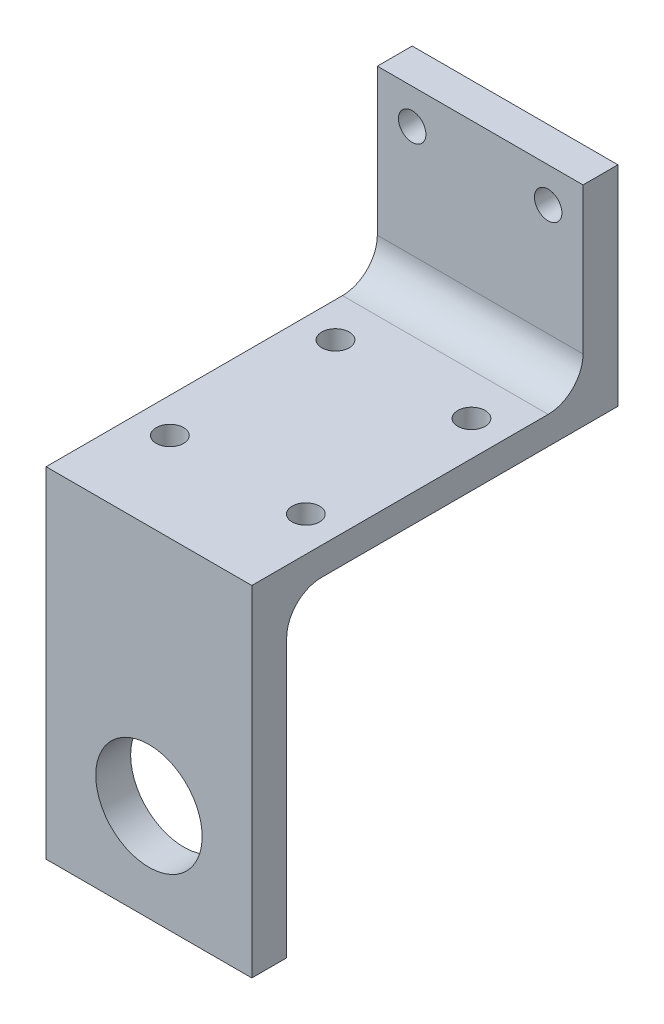
from build123d import *

# Parameters (mm, degrees)
BOSS_EXTRUDE1_DEPTH = 29.972
FILLET1_R           = 5.08
SKETCH3_R           = 2
SKETCH3_R_2         = 4
CUT_EXTRUDE1_DEPTH  = 5.08
SKETCH4_R           = 2
CUT_EXTRUDE2_DEPTH  = 29.972
SKETCH5_R           = 7.75
CUT_EXTRUDE3_DEPTH  = 5.08


with BuildPart() as part:
    # Sketch2 → Boss-Extrude1 (new body)
    with BuildSketch(Plane(origin=(0, 0, 0), x_dir=(0, 0, -1), z_dir=(1, 0, 0))):
        Polygon((6.609800113, 17.56515608), (6.609800113, -8.85084392), (-41.650199887, -8.85084392), (-41.650199887, -58.38084392), (-36.570199887, -58.38084392), (-36.570199887, -12.91484392), (11.689800113, -12.91484392), (11.689800113, 17.56515608), align=None)
    extrude(amount=BOSS_EXTRUDE1_DEPTH)

    # Fillet1
    fillet1_edges = [part.edges().sort_by_distance(p)[0] for p in [
        (14.986, -8.85084392, -6.609800113),
        (14.986, -12.91484392, 36.570199887),
    ]]
    fillet(fillet1_edges, radius=FILLET1_R)

    # Sketch3 → Cut-Extrude1 (cut)
    with BuildSketch(Plane(origin=(0, 0, -11.689800113), x_dir=(-1, 0, 0), z_dir=(0, 0, -1))):
        with Locations((-24.892, 12.48515608)):
            Circle(SKETCH3_R)
        with Locations((-5.08, 12.48515608)):
            Circle(SKETCH3_R)
        with Locations((-5.08, -11.64484392)):
            Circle(SKETCH3_R_2)
        with Locations((-24.892, -11.64484392)):
            Circle(SKETCH3_R_2)
    extrude(amount=-CUT_EXTRUDE1_DEPTH, mode=Mode.SUBTRACT)

    # Sketch4 → Cut-Extrude2 (cut)
    with BuildSketch(Plane.XZ.offset(12.91484392)):
        with Locations(Location((24.892, 4.566199887, 0), (0, 0, 270))):
            Circle(SKETCH4_R)
        with Locations(Location((5.08, 4.566199887, 0), (0, 0, 270))):
            Circle(SKETCH4_R)
        with Locations(Location((24.892, 28.696199887, 0), (0, 0, 270))):
            Circle(SKETCH4_R)
        with Locations(Location((5.08, 28.696199887, 0), (0, 0, 270))):
            Circle(SKETCH4_R)
    extrude(amount=-CUT_EXTRUDE2_DEPTH, mode=Mode.SUBTRACT)

    # Sketch5 → Cut-Extrude3 (cut)
    with BuildSketch(Plane(origin=(0, 0, 36.570199887), x_dir=(-1, 0, 0), z_dir=(0, 0, -1))):
        with Locations((-14.986, -44.15684392)):
            Circle(SKETCH5_R)
    extrude(amount=-CUT_EXTRUDE3_DEPTH, mode=Mode.SUBTRACT)


solid = part.part
